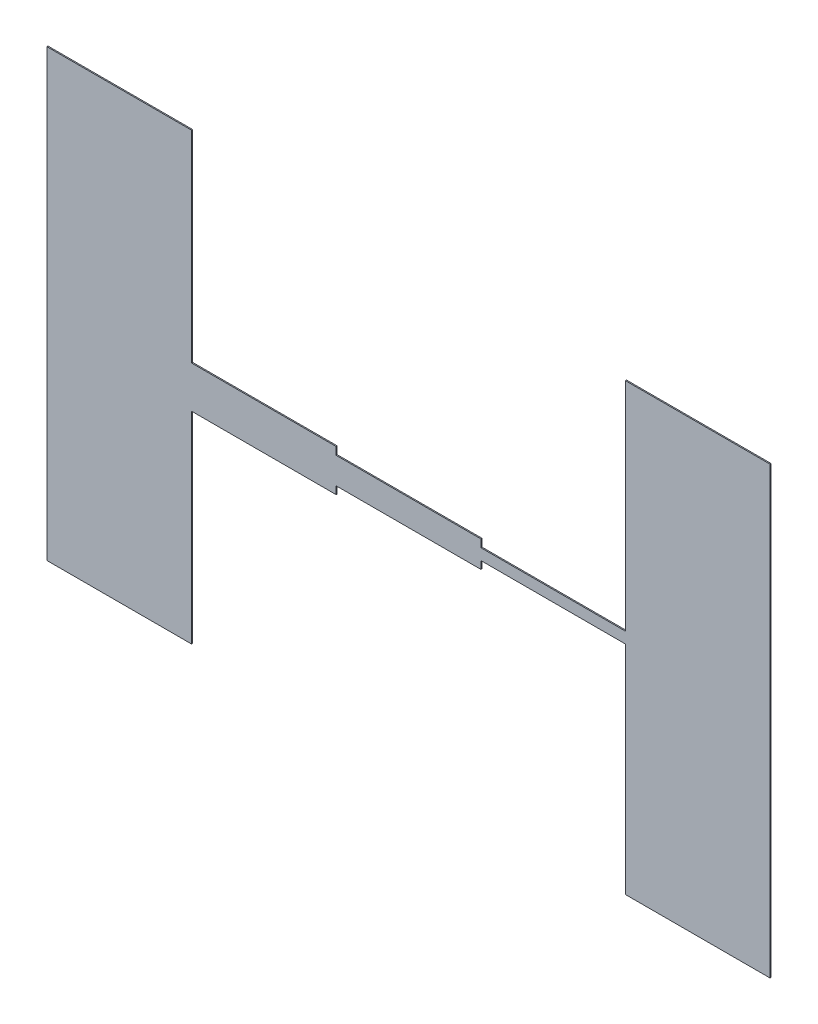
from build123d import *

# Parameters (mm, degrees)
BOSS_EXTRUDE1_DEPTH = 10


with BuildPart() as part:
    # Sketch1 → Boss-Extrude1 (new body)
    with BuildSketch(Plane.XY):
        Polygon((-650, -2000), (650, -2000), (650, -187.5), (1950, -187.5), (1950, -118.75), (3250, -118.75), (3250, -50), (4550, -50), (4550, -2000), (5850, -2000), (5850, 2000), (4550, 2000), (4550, 50), (3250, 50), (3250, 118.75), (1950, 118.75), (1950, 187.5), (650, 187.5), (650, 2000), (-650, 2000), align=None)
    extrude(amount=BOSS_EXTRUDE1_DEPTH)


solid = part.part
